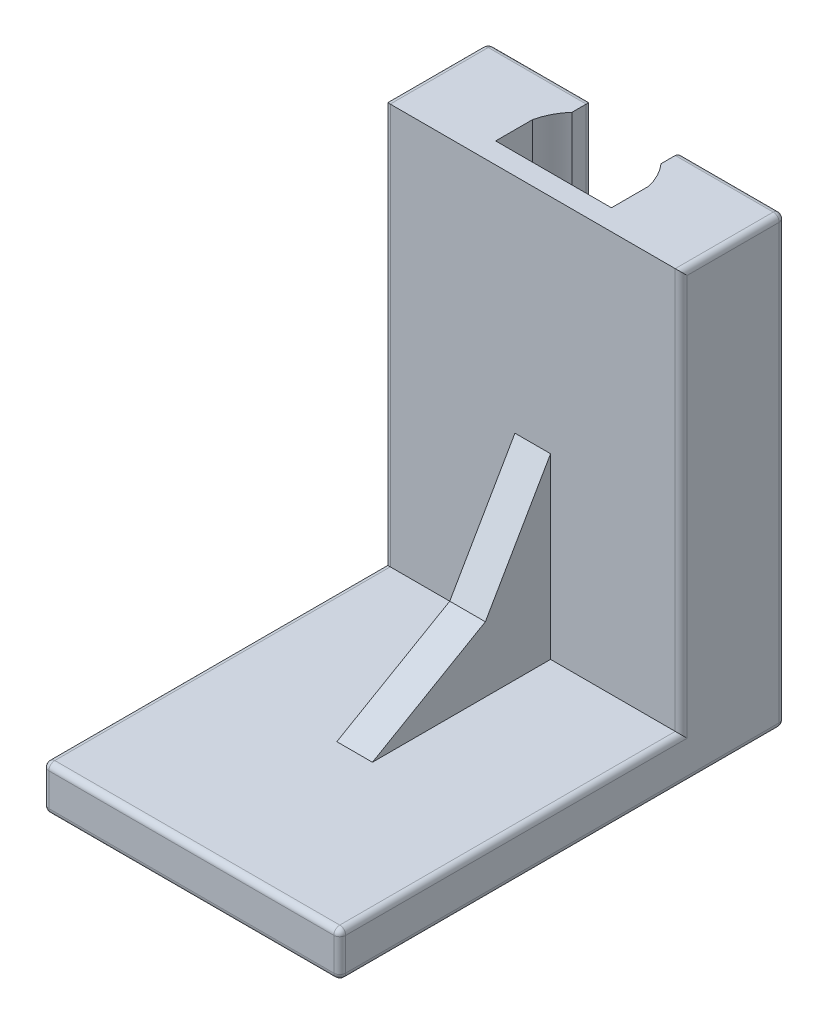
from build123d import *

# Parameters (mm, degrees)
EXTRUDE_1_DEPTH      = 5
EXTRUDE_1_DEPTH_BACK = 5
EXTRUDE_2_DEPTH      = 0.6
EXTRUDE_2_DEPTH_BACK = 0.6
SKETCH_3_W           = 3
SKETCH_3_H           = 3
EXTRUDE_3_DEPTH      = 1
EXTRUDE_4_DEPTH      = 1
EXTRUDE_4_DEPTH_BACK = 4
CUT_EXTRUDE_1_REACH  = 20.154
CUT_EXTRUDE_2_DEPTH  = 9.45
FILLET_1_R           = 0.1
FILLET_2_R           = 0.2


with BuildPart() as part:
    # 草图1 → 凸台-拉伸1 (new, two sides: drawn at the far end of the back side and taken through both)
    with BuildSketch(Plane(origin=(0, 0, 0), x_dir=(0, 0, -1), z_dir=(1, 0, 0)).offset(-EXTRUDE_1_DEPTH_BACK)):
        Polygon((-7.5, 0), (7.5, 0), (7.5, 15), (4, 15), (4, 1.5), (-7.5, 1.5), align=None)
    extrude(amount=EXTRUDE_1_DEPTH + EXTRUDE_1_DEPTH_BACK)

    # 草图2 → 凸台-拉伸2 (add, two sides: drawn at the far end of the back side and taken through both)
    with BuildSketch(Plane(origin=(0, 0, 0), x_dir=(0, 0, -1), z_dir=(1, 0, 0)).offset(-EXTRUDE_2_DEPTH_BACK)):
        Polygon((-2, 1.5), (1.803847577, 3.696152423), (4, 7.5), (4, 1.5), align=None)
    extrude(amount=EXTRUDE_2_DEPTH + EXTRUDE_2_DEPTH_BACK)

    # 草图3 → 凸台-拉伸3 (add)
    with BuildSketch(Plane.XZ):
        Rectangle(SKETCH_3_W, SKETCH_3_H)
    extrude(amount=EXTRUDE_3_DEPTH)

    # 草图4 → 凸台-拉伸4 (add, two sides: drawn at the far end of the back side and taken through both)
    with BuildSketch(Plane.XY.offset(1.5).offset(-EXTRUDE_4_DEPTH_BACK)):
        with BuildLine():
            Line((-1.95, -2.5), (1.95, -2.5))
            Line((1.95, -2.5), (1.95, -1.555590279))
            ThreePointArc((1.95, -1.555590279), (1.780042303, -1.088161527), (1.5, -0.677124344))
            Line((1.5, -0.677124344), (-1.5, -0.677124344))
            ThreePointArc((-1.5, -0.677124344), (-1.780042303, -1.088161527), (-1.95, -1.555590279))
            Line((-1.95, -1.555590279), (-1.95, -2.5))
        make_face()
    extrude(amount=EXTRUDE_4_DEPTH + EXTRUDE_4_DEPTH_BACK)

    # 草图5 → 切除-拉伸1 (cut, up to next)
    with BuildSketch(Plane.ZY.offset(1.95), mode=Mode.PRIVATE) as cut_extrude_1_sk1:
        with BuildLine():
            Line((-1.95, -2.5), (-1.95, -1.555590279))
            ThreePointArc((-1.95, -1.555590279), (-1.780042303, -1.088161527), (-1.5, -0.677124344))
            Line((-1.5, -0.677124344), (-2.5, -0.677124344))
            Line((-2.5, -0.677124344), (-2.5, -2.5))
            Line((-2.5, -2.5), (-1.95, -2.5))
        make_face()
    cut_extrude_1_tool1 = extrude(cut_extrude_1_sk1.sketch, amount=-CUT_EXTRUDE_1_REACH, mode=Mode.PRIVATE) & part.part
    # 草图5 → 切除-拉伸1 (cut, up to next)
    with BuildSketch(Plane.ZY.offset(1.95), mode=Mode.PRIVATE) as cut_extrude_1_sk2:
        with BuildLine():
            Line((2.5, -2.5), (2.5, -0.677124344))
            Line((2.5, -0.677124344), (1.5, -0.677124344))
            ThreePointArc((1.5, -0.677124344), (1.780042303, -1.088161527), (1.95, -1.555590279))
            Line((1.95, -1.555590279), (1.95, -2.5))
            Line((1.95, -2.5), (2.5, -2.5))
        make_face()
    cut_extrude_1_tool2 = extrude(cut_extrude_1_sk2.sketch, amount=-CUT_EXTRUDE_1_REACH, mode=Mode.PRIVATE) & part.part
    add(cut_extrude_1_tool1.solids().sort_by_distance((-1.95, -1.500125, -2.169375))[0], mode=Mode.SUBTRACT)
    add(cut_extrude_1_tool2.solids().sort_by_distance((-1.95, -1.500125, 2.169375))[0], mode=Mode.SUBTRACT)

    # 草图6 → 切除-拉伸2 (cut)
    with BuildSketch(Plane(origin=(0, 15, 0), x_dir=(-1, 0, 0), z_dir=(0, 1, 0))):
        with BuildLine():
            Line((1.5, -7.5), (-1.5, -7.5))
            Line((-1.5, -7.5), (-1.5, -6.822875656))
            ThreePointArc((-1.5, -6.822875656), (-1.780042303, -6.411838473), (-1.95, -5.944409721))
            Line((-1.95, -5.944409721), (-1.95, -4.7))
            Line((-1.95, -4.7), (1.95, -4.7))
            Line((1.95, -4.7), (1.95, -5.944409721))
            ThreePointArc((1.95, -5.944409721), (1.780042303, -6.411838473), (1.5, -6.822875656))
            Line((1.5, -6.822875656), (1.5, -7.5))
        make_face()
    extrude(amount=-CUT_EXTRUDE_2_DEPTH, mode=Mode.SUBTRACT)

    # 圆角1
    fillet_1_edges = [part.edges().sort_by_distance(p)[0] for p in [
        (1.95, -2.5, 0),
        (0, -2.5, -1.95),
        (-1.95, -2.5, 0),
        (0, -2.5, 1.95),
    ]]
    fillet(fillet_1_edges, radius=FILLET_1_R)

    # 圆角2
    fillet_2_edges = [part.edges().sort_by_distance(p)[0] for p in [
        (-3.25, 15, -7.5),
        (0, 0, -7.5),
        (3.25, 15, -7.5),
        (1.5, 10.275, -7.5),
        (0, 5.55, -7.5),
        (-1.5, 10.275, -7.5),
        (-5, 0, 0),
        (-5, 7.5, -7.5),
        (-5, 15, -5.75),
        (-5, 8.25, -4),
        (-5, 1.5, 1.75),
        (-5, 0.75, 7.5),
        (5, 1.5, 1.75),
        (5, 8.25, -4),
        (5, 15, -5.75),
        (5, 7.5, -7.5),
        (5, 0, 0),
        (5, 0.75, 7.5),
        (0, 1.5, 7.5),
        (0, 0, 7.5),
    ]]
    fillet(fillet_2_edges, radius=FILLET_2_R)


solid = part.part
